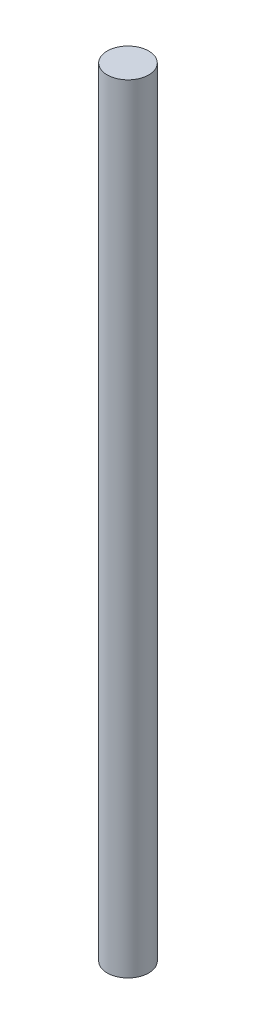
from build123d import *

# Parameters (mm, degrees)
SKETCH1_R           = 4
BOSS_EXTRUDE1_DEPTH = 150


with BuildPart() as part:
    # Sketch1 → Boss-Extrude1 (new body)
    with BuildSketch(Plane(origin=(0, 0, 0), x_dir=(1, 0, 0), z_dir=(0, 1, 0))):
        with Locations(Location((0, 0, 0), (0, 0, 270))):
            Circle(SKETCH1_R)
    extrude(amount=BOSS_EXTRUDE1_DEPTH)


solid = part.part
